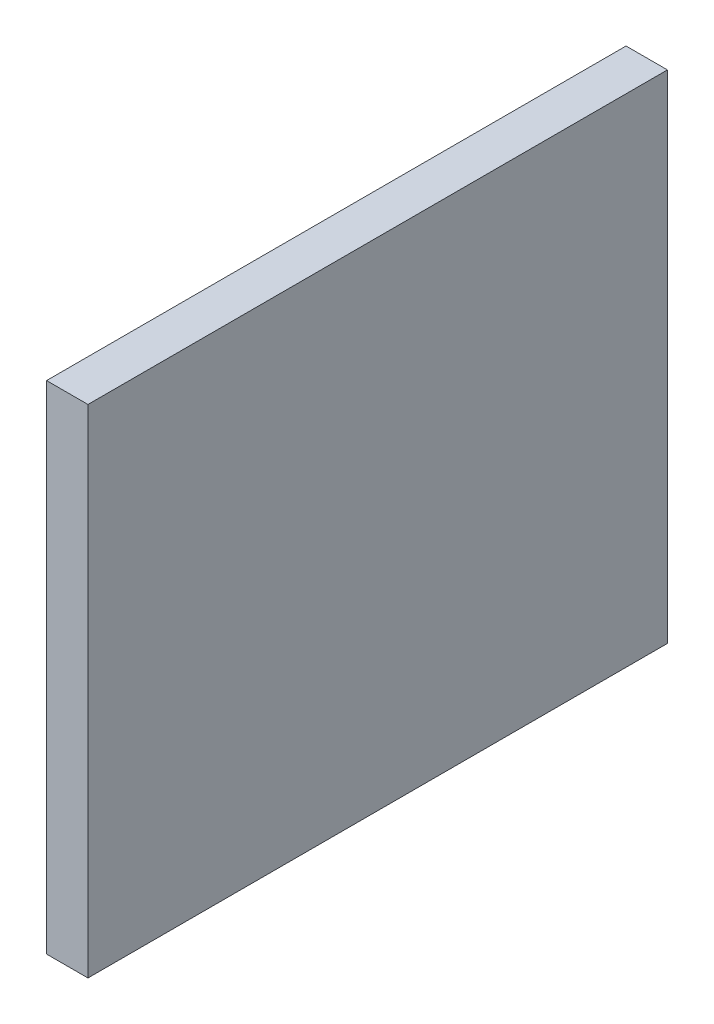
from build123d import *

# Parameters (mm, degrees)
SKETCH1_W           = 70
SKETCH1_H           = 60
BOSS_EXTRUDE1_DEPTH = 5


with BuildPart() as part:
    # Sketch1 → Boss-Extrude1 (new body)
    with BuildSketch(Plane(origin=(0, 0, 0), x_dir=(0, 0, -1), z_dir=(1, 0, 0))):
        with Locations((35, -30)):
            Rectangle(SKETCH1_W, SKETCH1_H)
    extrude(amount=BOSS_EXTRUDE1_DEPTH)


solid = part.part
